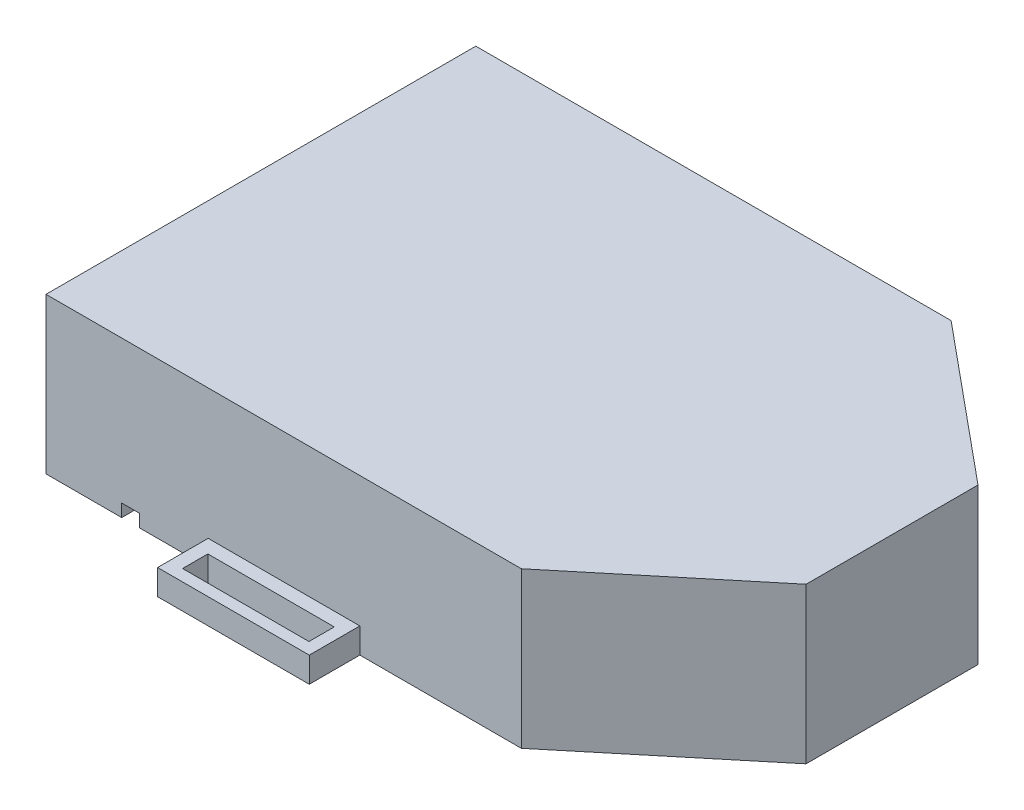
from build123d import *

# Parameters (mm, degrees)
SKETCH1_W           = 85
SKETCH1_H           = 35
BOSS_EXTRUDE1_DEPTH = 145.5
SKETCH4_R           = 12.75
CUT_EXTRUDE2_DEPTH  = 55
CUT_EXTRUDE3_DEPTH  = 156.705651792
SKETCH11_W          = 12
SKETCH11_H          = 25.5
CUT_EXTRUDE5_DEPTH  = 10
CUT_EXTRUDE6_DEPTH  = 2.5
SKETCH14_W          = 30
SKETCH14_H          = 10
SKETCH14_W_2        = 25
SKETCH14_H_2        = 5
BOSS_EXTRUDE2_DEPTH = 5
CUT_EXTRUDE12_REACH = 138.729
SKETCH16_W          = 85
SKETCH16_H          = 4.239608998


with BuildPart() as part:
    # Sketch1 → Boss-Extrude1 (new body)
    with BuildSketch(Plane(origin=(0, 0, 0), x_dir=(0, 0, -1), z_dir=(1, 0, 0))):
        with Locations((-0.5, 0)):
            Rectangle(SKETCH1_W, SKETCH1_H)
    extrude(amount=BOSS_EXTRUDE1_DEPTH)

    # Sketch4 → Cut-Extrude2 (cut)
    with BuildSketch(Plane.ZY):
        Circle(SKETCH4_R)
    extrude(amount=-CUT_EXTRUDE2_DEPTH, mode=Mode.SUBTRACT)

    # Sketch9 → Cut-Extrude3 (cut, through all)
    with BuildSketch(Plane(origin=(0, 17.5, 0), x_dir=(1, 0, 0), z_dir=(0, 1, 0))):
        Polygon((145.5, 42), (94, 42), (124.818014212, 16.5), (124.818014212, -17.5), (94, -43), (145.5, -43), align=None)
    extrude(amount=-CUT_EXTRUDE3_DEPTH, mode=Mode.SUBTRACT)

    # Sketch11 → Cut-Extrude5 (cut)
    with BuildSketch(Plane.XZ.offset(17.5)):
        with Locations((49, 0)):
            Rectangle(SKETCH11_W, SKETCH11_H)
    extrude(amount=-CUT_EXTRUDE5_DEPTH, mode=Mode.SUBTRACT)

    # Sketch12 → Cut-Extrude6 (cut)
    with BuildSketch(Plane.XZ.offset(17.5)):
        Polygon((50.974497594, 39.527447374), (48.784580707, 39.527447374), (18.473843114, 39.527447374), (18.473843114, 43), (14.973843114, 43), (14.973843114, 39.527447374), (14.973843114, 36.086149409), (47.474497594, 36.086149409), (47.474497594, 12.75), (50.974497594, 12.75), (50.974497594, 36.086149409), align=None)
    extrude(amount=-CUT_EXTRUDE6_DEPTH, mode=Mode.SUBTRACT)

    # Sketch14 → Boss-Extrude2 (add)
    # profile 1 of 2: a face of its own
    with BuildSketch(Plane.XZ.offset(17.5)):
        with Locations((47.067654603, -47)):
            Rectangle(SKETCH14_W, SKETCH14_H)
        with Locations((47.207687623, -47.202155092)):
            Rectangle(SKETCH14_W_2, SKETCH14_H_2, mode=Mode.SUBTRACT)
    # profile 2 of 2: a face of its own
    with BuildSketch(Plane.XZ.offset(17.5)):
        with Locations((47.067654603, 48)):
            Rectangle(SKETCH14_W, SKETCH14_H)
        with Locations((47.207687623, 48.202155092)):
            Rectangle(SKETCH14_W_2, SKETCH14_H_2, mode=Mode.SUBTRACT)
    extrude(amount=-BOSS_EXTRUDE2_DEPTH)

    # Sketch16 → Cut-Extrude12 (cut, up to next)
    with BuildSketch(Plane.ZY, mode=Mode.PRIVATE) as cut_extrude12_sk1:
        with Locations((0.5, 15.380195501)):
            Rectangle(SKETCH16_W, SKETCH16_H)
    cut_extrude12_tool1 = extrude(cut_extrude12_sk1.sketch, amount=-CUT_EXTRUDE12_REACH, mode=Mode.PRIVATE) & part.part
    add(cut_extrude12_tool1.solids().sort_by_distance((0, 15.380196, 0.5))[0], mode=Mode.SUBTRACT)


solid = part.part
